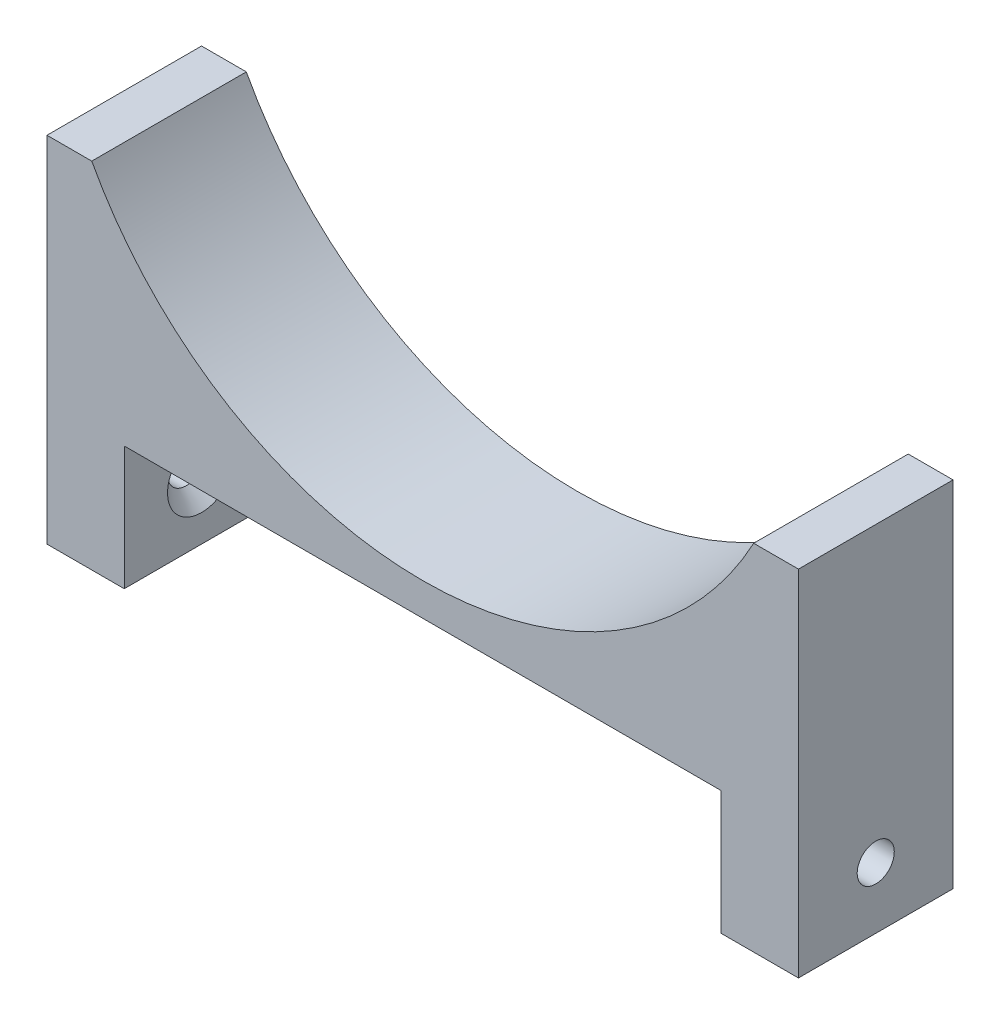
from build123d import *

# Parameters (mm, degrees)
BOSS_EXTRUDE1_DEPTH = 10


with BuildPart() as part:
    # Sketch1 → Boss-Extrude1 (new body)
    with BuildSketch(Plane.XY):
        with BuildLine():
            Line((-9.709376273, 1.641432906), (-9.709376273, -21.269563621))
            Line((-9.709376273, -21.269563621), (-4.709376273, -21.269563621))
            Line((-4.709376273, -21.269563621), (-4.709376273, -13.269563621))
            Line((-4.709376273, -13.269563621), (14.600623727, -13.269563621))
            Line((14.600623727, -13.269563621), (14.600623727, -11.159563621))
            ThreePointArc((14.600623727, -11.159563621), (2.126806638, -7.715324743), (-6.812431614, 1.641432906))
            Line((-6.812431614, 1.641432906), (-9.709376273, 1.641432906))
        make_face()
        with BuildLine():
            Line((14.600623727, -11.159563621), (14.600623727, -13.269563621))
            Line((14.600623727, -13.269563621), (33.910623727, -13.269563621))
            Line((33.910623727, -13.269563621), (33.910623727, -21.269563621))
            Line((33.910623727, -21.269563621), (38.910623727, -21.269563621))
            Line((38.910623727, -21.269563621), (38.910623727, 1.641432906))
            Line((38.910623727, 1.641432906), (36.013679069, 1.641432906))
            ThreePointArc((36.013679069, 1.641432906), (27.074440817, -7.715324743), (14.600623727, -11.159563621))
        make_face()
    extrude(amount=BOSS_EXTRUDE1_DEPTH)

    # Sketch4 → CSK for M2 Countersunk Flat Head Screw1 (revolve, cut)
    with BuildSketch(Plane(origin=(-4.709376273, -17.301406974, 5), x_dir=(0, 0, -1), z_dir=(0, 1, 0))):
        Polygon((0, 0), (0, 17.221032743), (1.2, 16.5), (1.2, 1), (2.2, 0), align=None)
    csk_for_m2_countersunk_flat_head_screw1 = revolve(axis=Axis((1.640623727, -17.301406974, 5), (-1, 0, 0)), mode=Mode.SUBTRACT)

    # Mirror2: CSK for M2 Countersunk Flat Head Screw1 across plane
    add(csk_for_m2_countersunk_flat_head_screw1.mirror(Plane(origin=(14.600623727, 0, 0), x_dir=(0, 0, 1), z_dir=(1, 0, 0))), mode=Mode.SUBTRACT)


solid = part.part
